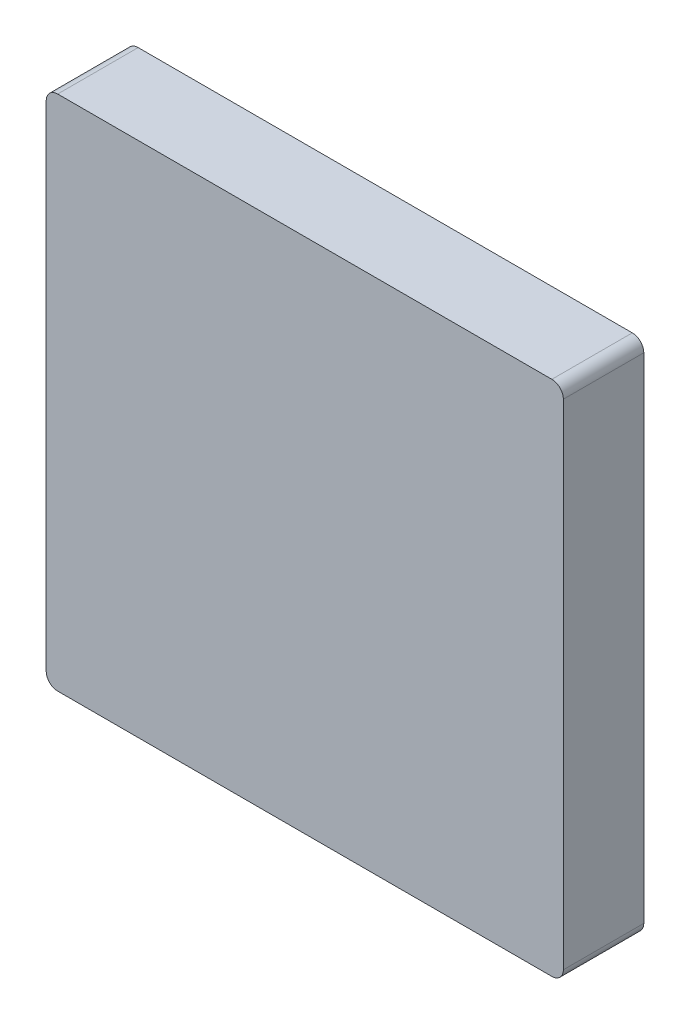
from build123d import *

# Parameters (mm, degrees)
EXTRUDE_1_DEPTH = 0.7


with BuildPart() as part:
    # 草图1 → 凸台-拉伸1 (new body)
    with BuildSketch(Plane.XY):
        with BuildLine():
            Line((-6.337861272, 7.582369942), (-2.037861272, 7.582369942))
            ThreePointArc((-2.037861272, 7.582369942), (-1.967150594, 7.55308062), (-1.937861272, 7.482369942))
            Line((-1.937861272, 7.482369942), (-1.937861272, 3.182369942))
            ThreePointArc((-1.937861272, 3.182369942), (-1.967150594, 3.111659264), (-2.037861272, 3.082369942))
            Line((-2.037861272, 3.082369942), (-6.337861272, 3.082369942))
            ThreePointArc((-6.337861272, 3.082369942), (-6.40857195, 3.111659264), (-6.437861272, 3.182369942))
            Line((-6.437861272, 3.182369942), (-6.437861272, 7.482369942))
            ThreePointArc((-6.437861272, 7.482369942), (-6.40857195, 7.55308062), (-6.337861272, 7.582369942))
        make_face()
    extrude(amount=EXTRUDE_1_DEPTH)


solid = part.part
